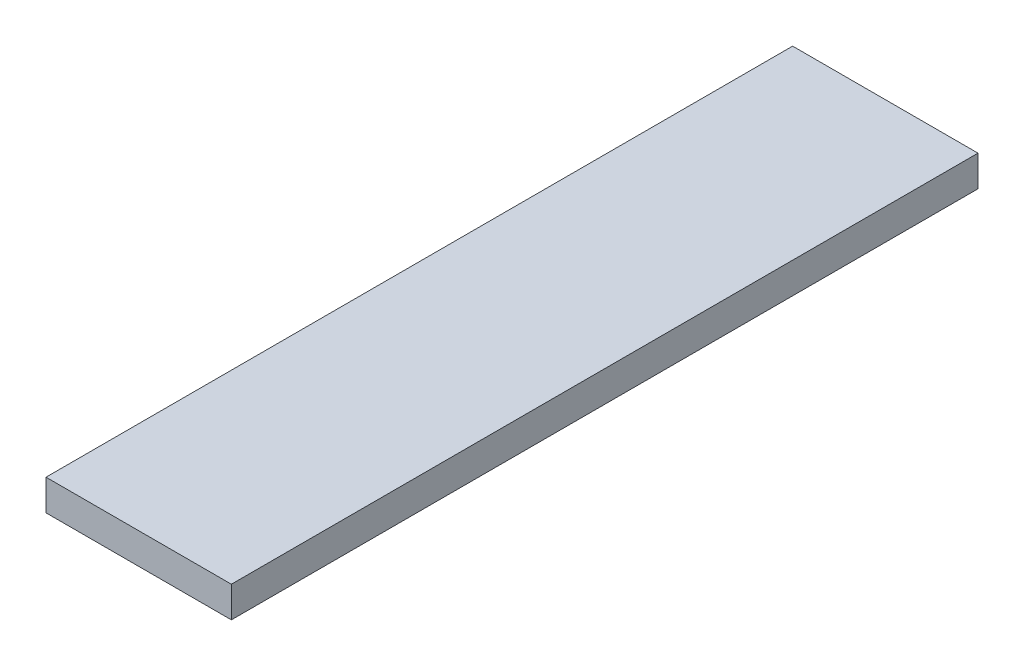
from build123d import *

# Parameters (mm, degrees)
SKETCH1_W               = 14.8
SKETCH1_H               = 2.8
BOSS_EXTRUDE1_DEPTH     = 54
CUT_EXTRUDE1_DEPTH      = 103.444717826
CUT_EXTRUDE1_DEPTH_BACK = 103.444717826
SKETCH2_W               = 14.8
SKETCH2_H               = 2.8
SKETCH2_W_2             = 14.4
SKETCH2_H_2             = 2.4
SKETCH3_W               = 14.4
SKETCH3_H               = 2.4
BOSS_EXTRUDE2_DEPTH     = 4


with BuildPart() as part:
    # Sketch1 → Boss-Extrude1 (new body)
    with BuildSketch(Plane.XY):
        with Locations((-79.545731411, -3)):
            Rectangle(SKETCH1_W, SKETCH1_H)
    extrude(amount=BOSS_EXTRUDE1_DEPTH)

    # Sketch2 → Cut-Extrude1 (cut, two sides: drawn at the far end of the back side and taken through both)
    with BuildSketch(Plane(origin=(0, 0, 0), x_dir=(-1, 0, 0), z_dir=(0, 0, -1)).offset(-CUT_EXTRUDE1_DEPTH_BACK)):
        with Locations((79.545731411, -3)):
            Rectangle(SKETCH2_W, SKETCH2_H)
        with Locations((79.545731411, -3)):
            Rectangle(SKETCH2_W_2, SKETCH2_H_2, mode=Mode.SUBTRACT)
    extrude(amount=CUT_EXTRUDE1_DEPTH + CUT_EXTRUDE1_DEPTH_BACK, mode=Mode.SUBTRACT)

    # Sketch3 → Boss-Extrude2 (add)
    with BuildSketch(Plane(origin=(0, 0, 0), x_dir=(-1, 0, 0), z_dir=(0, 0, -1))):
        with Locations((79.545731411, -3)):
            Rectangle(SKETCH3_W, SKETCH3_H)
    extrude(amount=BOSS_EXTRUDE2_DEPTH)


solid = part.part
